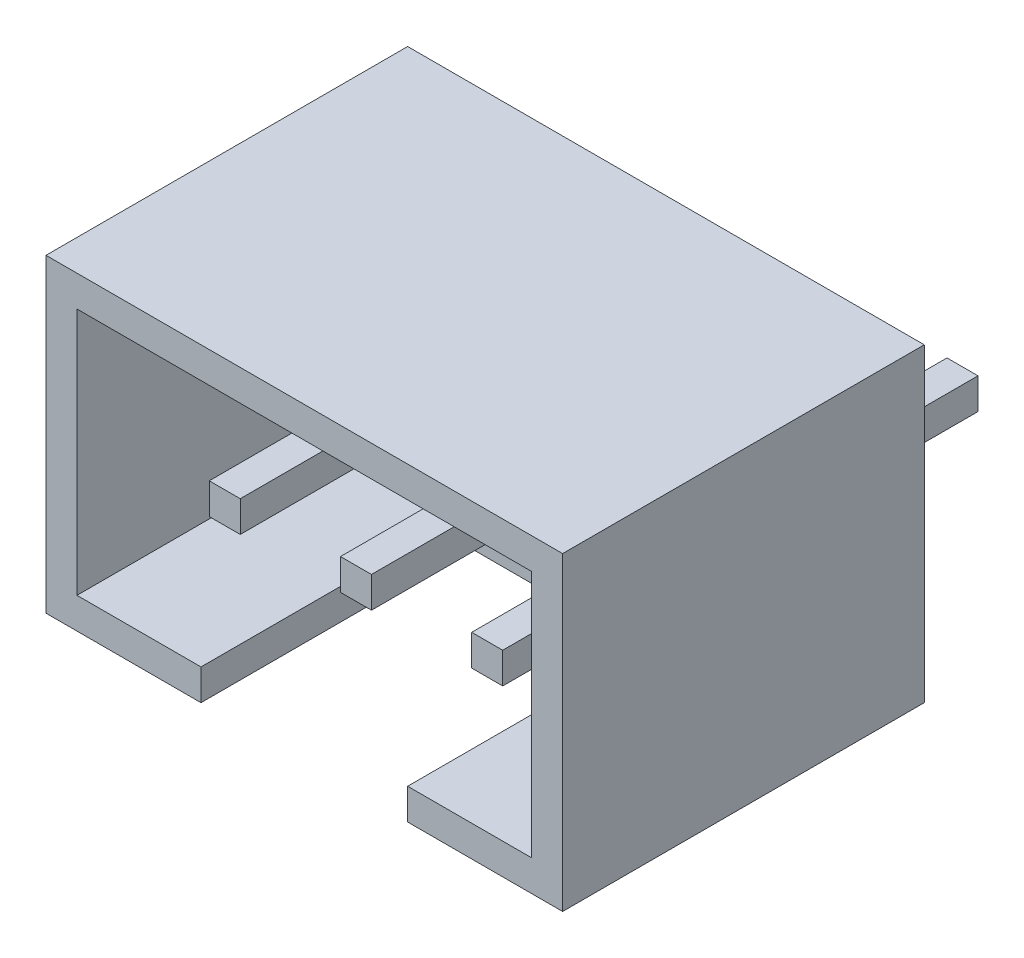
from build123d import *

# Parameters (mm, degrees)
SKETCH1_W           = 10
SKETCH1_H           = 6
BOSS_EXTRUDE1_DEPTH = 1.8
BOSS_EXTRUDE2_DEPTH = 5.2
BOSS_EXTRUDE3_START = -5
SKETCH3_W           = 0.6
SKETCH3_H           = 0.6
BOSS_EXTRUDE3_DEPTH = 9.2
LPATTERN1_COUNT     = 3
LPATTERN1_PITCH     = 2.54


with BuildPart() as part:
    # Sketch1 → Boss-Extrude1 (new body)
    with BuildSketch(Plane.XY):
        Rectangle(SKETCH1_W, SKETCH1_H)
    extrude(amount=BOSS_EXTRUDE1_DEPTH)

    # Sketch2 → Boss-Extrude2 (add)
    with BuildSketch(Plane.XY.offset(1.8)):
        Polygon((-2, -3), (-2, -2.4), (-4.4, -2.4), (-4.4, 2.4), (4.4, 2.4), (4.4, -2.4), (2, -2.4), (2, -3), (5, -3), (5, 3), (-5, 3), (-5, -3), align=None)
    extrude(amount=BOSS_EXTRUDE2_DEPTH)

    # Sketch3 → Boss-Extrude3 (add)
    with BuildSketch(Plane.XY.offset(1.8).offset(BOSS_EXTRUDE3_START)):
        with Locations((-2.54, -0.5)):
            Rectangle(SKETCH3_W, SKETCH3_H)
    boss_extrude3 = extrude(amount=BOSS_EXTRUDE3_DEPTH)

    # LPattern1: Boss-Extrude3 ×3
    with Locations(*[(i * LPATTERN1_PITCH, 0, 0) for i in range(1, LPATTERN1_COUNT)]):
        add(boss_extrude3)


solid = part.part
